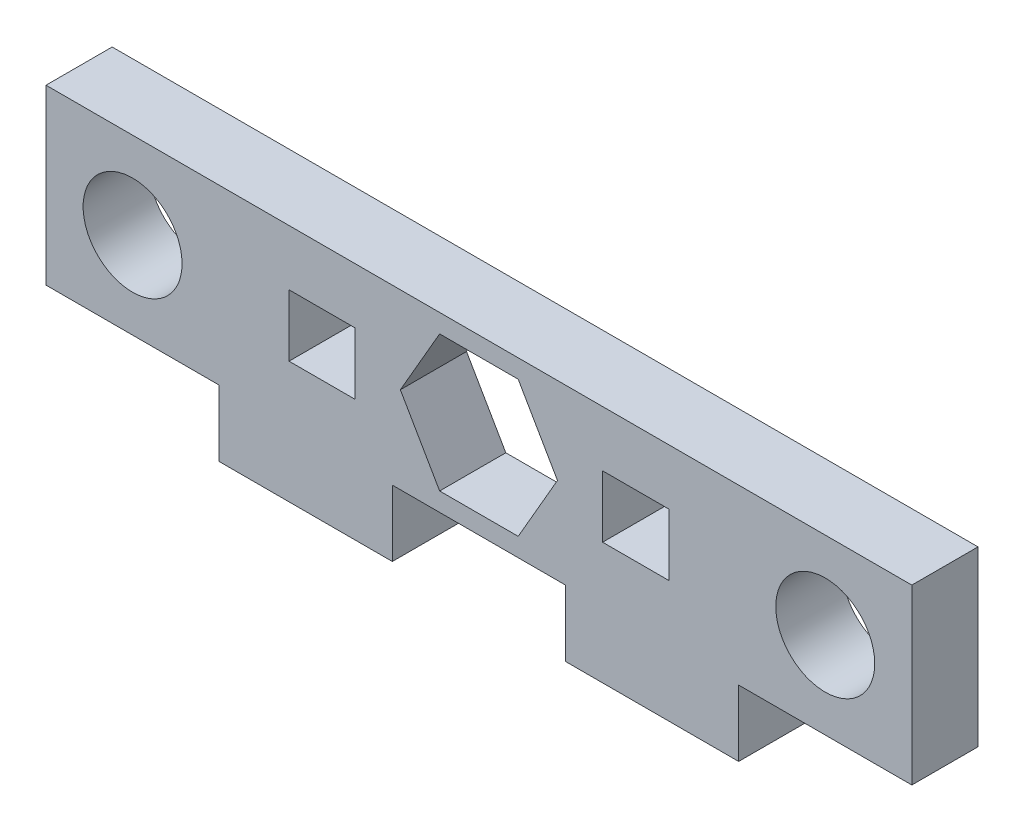
from build123d import *

# Parameters (mm, degrees)
MODEL_R             = 4
MODEL_W             = 5.350001156
MODEL_H             = 4.999999889
MODEL_W_2           = 5.349997431
BOSS_EXTRUDE1_DEPTH = 5.35


with BuildPart() as part:
    # Model → Boss-Extrude1 (new body)
    with BuildSketch(Plane.XY):
        Polygon((70.000000298, 5.350000225), (70.000000298, 19.350000657), (0, 19.350000657), (0, 5.350000225), (13.99999857, 5.350000225), (13.99999857, 0), (28.000000864, 0), (28.000000864, 5.350000225), (41.999999434, 5.350000225), (41.999999434, 0), (55.999999866, 0), (55.999999866, 5.350000225), align=None)
        with Locations((7.000000298, 12.350000225)):
            Circle(MODEL_R, mode=Mode.SUBTRACT)
        with Locations((63.000000298, 12.350000225)):
            Circle(MODEL_R, mode=Mode.SUBTRACT)
        with Locations((47.675000504, 12.349999976)):
            Rectangle(MODEL_W, MODEL_H, mode=Mode.SUBTRACT)
        with Locations((22.324999795, 12.349999976)):
            Rectangle(MODEL_W_2, MODEL_H, mode=Mode.SUBTRACT)
        Polygon((41.350852698, 12.350000441), (38.175426424, 17.850000411), (31.824573874, 17.850000411), (28.6491476, 12.350000441), (31.824573874, 6.850000238), (38.175426424, 6.850000238), align=None, mode=Mode.SUBTRACT)
    extrude(amount=BOSS_EXTRUDE1_DEPTH)


solid = part.part
